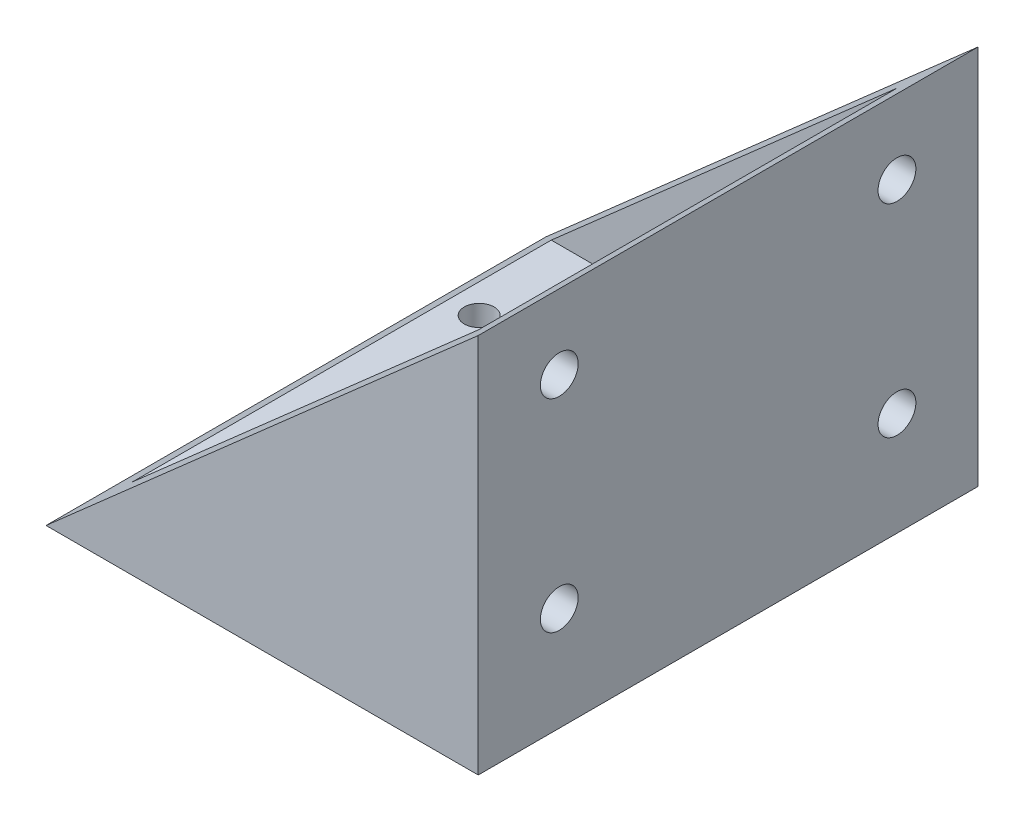
from build123d import *

# Parameters (mm, degrees)
EXTRUDE_1_DEPTH     = 37
SHELL_1_T           = -3
SKETCH_2_R          = 1.1
CUT_EXTRUDE_1_DEPTH = 30
SKETCH_3_R          = 6.5
CUT_EXTRUDE_2_DEPTH = 5
SKETCH_4_R          = 1.4
CUT_EXTRUDE_3_DEPTH = 5


with BuildPart() as part:
    # ｽｹｯﾁ1 → ﾎﾞｽ - 押し出し1 (new body)
    with BuildSketch(Plane.XY):
        Polygon((0, 0), (32, 0), (32, 28.179721765), align=None)
    extrude(amount=EXTRUDE_1_DEPTH)

    # ｼｪﾙ1
    shell_1_openings = [part.faces().sort_by_distance(p)[0] for p in [
        (16, 14.089860882, 18.5),
    ]]
    offset(amount=SHELL_1_T, openings=shell_1_openings, kind=Kind.INTERSECTION)

    # ｽｹｯﾁ2 → ｶｯﾄ - 押し出し1 (cut)
    with BuildSketch(Plane.XZ):
        with Locations(Location((26.57, 10.5, 0), (0, 0, 270))):
            Circle(SKETCH_2_R)
        with Locations(Location((5.57, 10.5, 0), (0, 0, 270))):
            Circle(SKETCH_2_R)
        with Locations(Location((5.57, 31.5, 0), (0, 0, 270))):
            Circle(SKETCH_2_R)
        with Locations(Location((26.57, 31.5, 0), (0, 0, 270))):
            Circle(SKETCH_2_R)
    extrude(amount=-CUT_EXTRUDE_1_DEPTH, mode=Mode.SUBTRACT)

    # ｽｹｯﾁ3 → ｶｯﾄ - 押し出し2 (cut)
    with BuildSketch(Plane.XZ):
        with Locations(Location((16.07, 10.5, 0), (0, 0, 270))):
            Circle(SKETCH_3_R)
    extrude(amount=-CUT_EXTRUDE_2_DEPTH, mode=Mode.SUBTRACT)

    # ｽｹｯﾁ4 → ｶｯﾄ - 押し出し3 (cut)
    with BuildSketch(Plane(origin=(32, 0, 0), x_dir=(0, 0, -1), z_dir=(1, 0, 0))):
        with Locations((-6, 22.679721765)):
            Circle(SKETCH_4_R)
        with Locations((-31, 22.679721765)):
            Circle(SKETCH_4_R)
        with Locations((-31, 7.679721765)):
            Circle(SKETCH_4_R)
        with Locations((-6, 7.679721765)):
            Circle(SKETCH_4_R)
    extrude(amount=-CUT_EXTRUDE_3_DEPTH, mode=Mode.SUBTRACT)


solid = part.part
